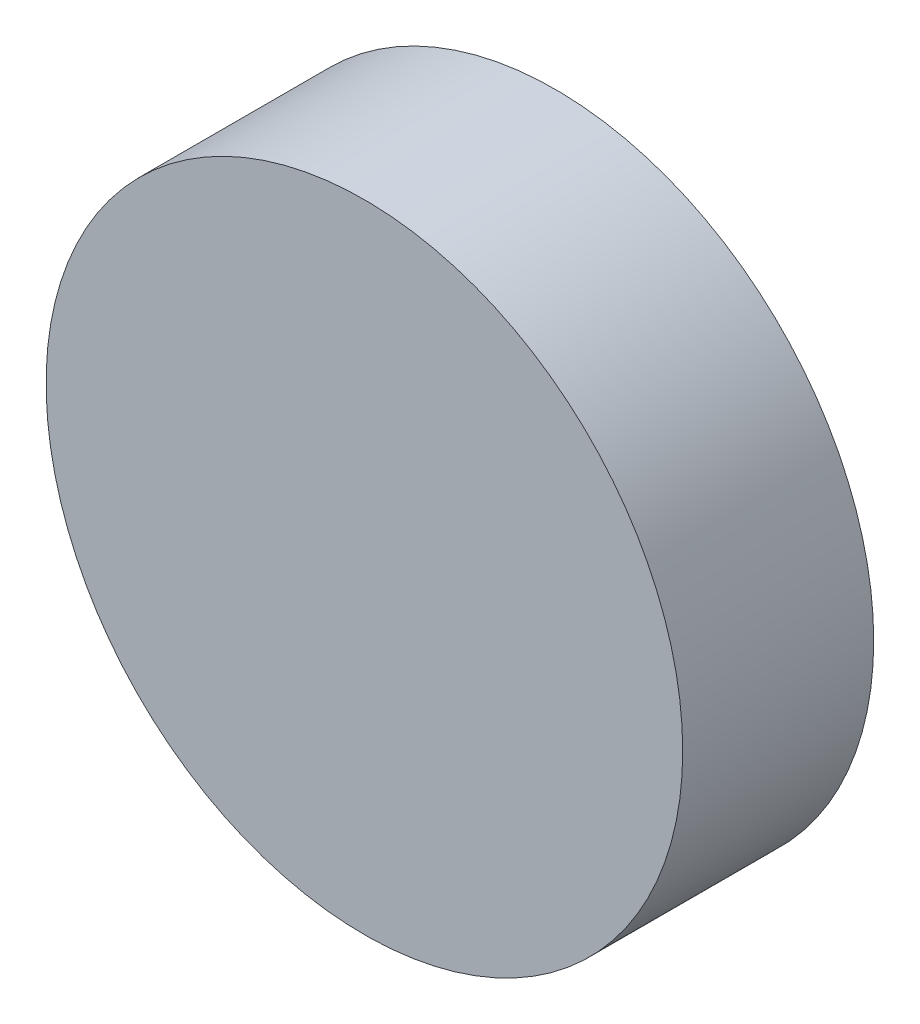
from build123d import *

# Parameters (mm, degrees)
SKETCH1_R           = 95.25
BOSS_EXTRUDE1_DEPTH = 28.575


with BuildPart() as part:
    # Sketch1 → Boss-Extrude1 (new, symmetric)
    with BuildSketch(Plane(origin=(0, 0, 0), x_dir=(0, 1, 0), z_dir=(0, 0, 1))):
        with Locations(Location((0, 0, 0), (0, 0, 270))):
            Circle(SKETCH1_R)
    extrude(amount=BOSS_EXTRUDE1_DEPTH, both=True)


solid = part.part
